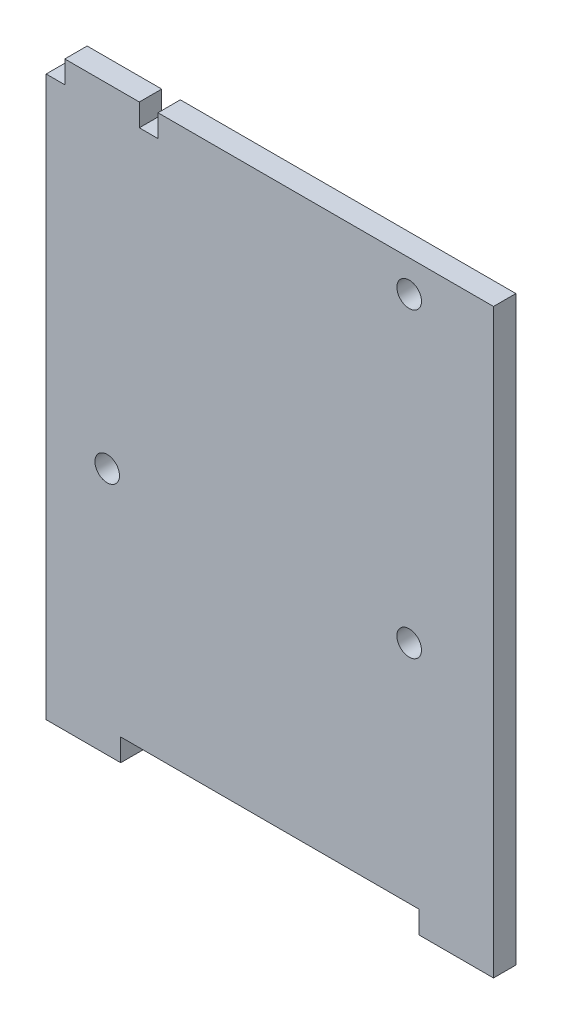
from build123d import *

# Parameters (mm, degrees)
SKETCH1_W              = 60
SKETCH1_H              = 75
MAINBODY_DEPTH         = 1.5
SHAFT_HOLES_DEPTH      = 110.668819634
SHAFT_HOLES_DEPTH_BACK = 110.668819634
SKETCH3_R              = 1.65
SKETCH4_W              = 10
SKETCH4_H              = 3
BASETABS_DEPTH         = 1.5
SKETCH5_W              = 2.5
SKETCH5_H              = 3
CUT_EXTRUDE2_DEPTH     = 110.69958979


with BuildPart() as part:
    # Sketch1 → MainBody (new, symmetric)
    with BuildSketch(Plane.XY):
        with Locations((50, 37.5)):
            Rectangle(SKETCH1_W, SKETCH1_H)
    extrude(amount=MAINBODY_DEPTH, both=True)

    # Sketch3 → Shaft Holes (cut, two sides: drawn at the far end of the back side and taken through both)
    with BuildSketch(Plane.XY.offset(-SHAFT_HOLES_DEPTH_BACK)):
        with Locations((28.190778624, 30.2606043)):
            Circle(SKETCH3_R)
        with Locations((68.690778624, 30.2606043)):
            Circle(SKETCH3_R)
        with Locations((68.690778624, 70.7606043)):
            Circle(SKETCH3_R)
    extrude(amount=SHAFT_HOLES_DEPTH + SHAFT_HOLES_DEPTH_BACK, mode=Mode.SUBTRACT)

    # Sketch4 → BaseTabs (add, symmetric)
    with BuildSketch(Plane.XY):
        with Locations((25, -1.5)):
            Rectangle(SKETCH4_W, SKETCH4_H)
        with Locations((75, -1.5)):
            Rectangle(SKETCH4_W, SKETCH4_H)
    extrude(amount=BASETABS_DEPTH, both=True)

    # Sketch5 → Cut-Extrude2 (cut, through all)
    with BuildSketch(Plane.XY.offset(1.5)):
        with Locations((21.25, 73.5)):
            Rectangle(SKETCH5_W, SKETCH5_H)
        with Locations((33.75, 73.5)):
            Rectangle(SKETCH5_W, SKETCH5_H)
    extrude(amount=-CUT_EXTRUDE2_DEPTH, mode=Mode.SUBTRACT)


solid = part.part
